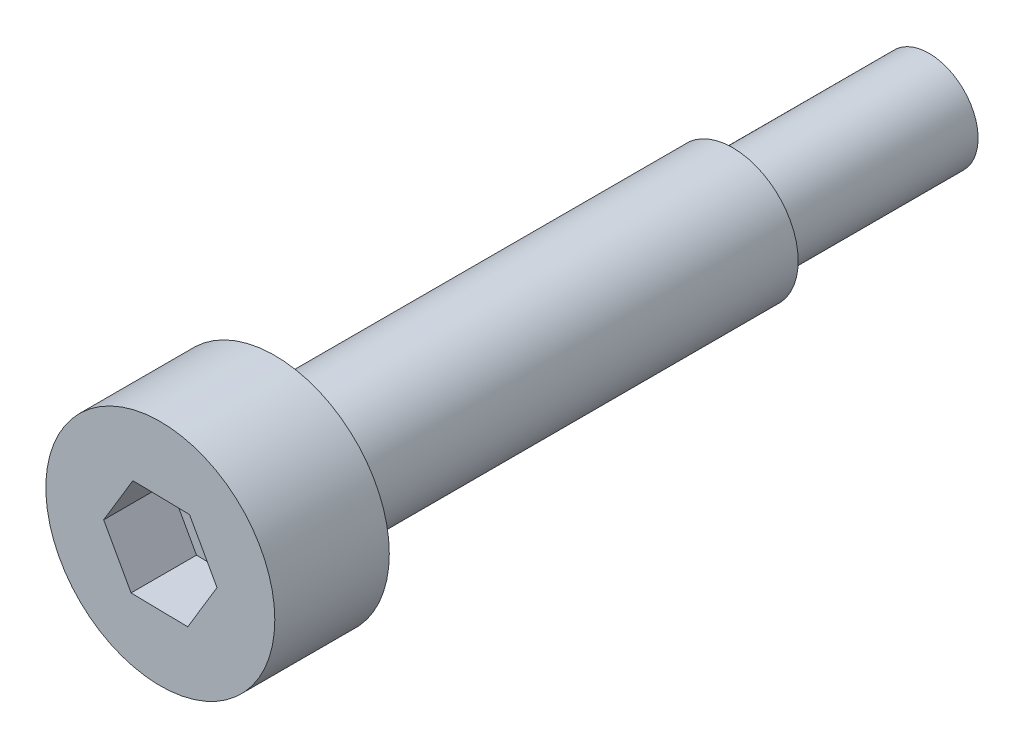
from build123d import *

# Parameters (mm, degrees)
SKETCH_1_R          = 3.5
EXTRUDE_1_DEPTH     = 3.5
CUT_EXTRUDE_1_DEPTH = 2
SKETCH_3_R          = 2
EXTRUDE_2_DEPTH     = 14
SKETCH_4_R          = 1.5
EXTRUDE_3_DEPTH     = 6


with BuildPart() as part:
    # 草图1 → 凸台-拉伸1 (new body)
    with BuildSketch(Plane.XY):
        Circle(SKETCH_1_R)
    extrude(amount=EXTRUDE_1_DEPTH)

    # 草图2 → 切除-拉伸1 (cut)
    with BuildSketch(Plane.XY.offset(3.5)):
        Polygon((0.893639487, 1.483714416), (-0.838114632, 1.515771705), (-1.731754119, 0.03205729), (-0.893639487, -1.483714416), (0.838114632, -1.515771705), (1.731754119, -0.03205729), align=None)
    extrude(amount=-CUT_EXTRUDE_1_DEPTH, mode=Mode.SUBTRACT)

    # 草图3 → 凸台-拉伸2 (add)
    with BuildSketch(Plane(origin=(0, 0, 0), x_dir=(-1, 0, 0), z_dir=(0, 0, -1))):
        with Locations(Location((0, 0, 0), (0, 0, 180))):
            Circle(SKETCH_3_R)
    extrude(amount=EXTRUDE_2_DEPTH)

    # 草图4 → 凸台-拉伸3 (add)
    with BuildSketch(Plane(origin=(0, 0, -14), x_dir=(-1, 0, 0), z_dir=(0, 0, -1))):
        Circle(SKETCH_4_R)
    extrude(amount=EXTRUDE_3_DEPTH)


solid = part.part
